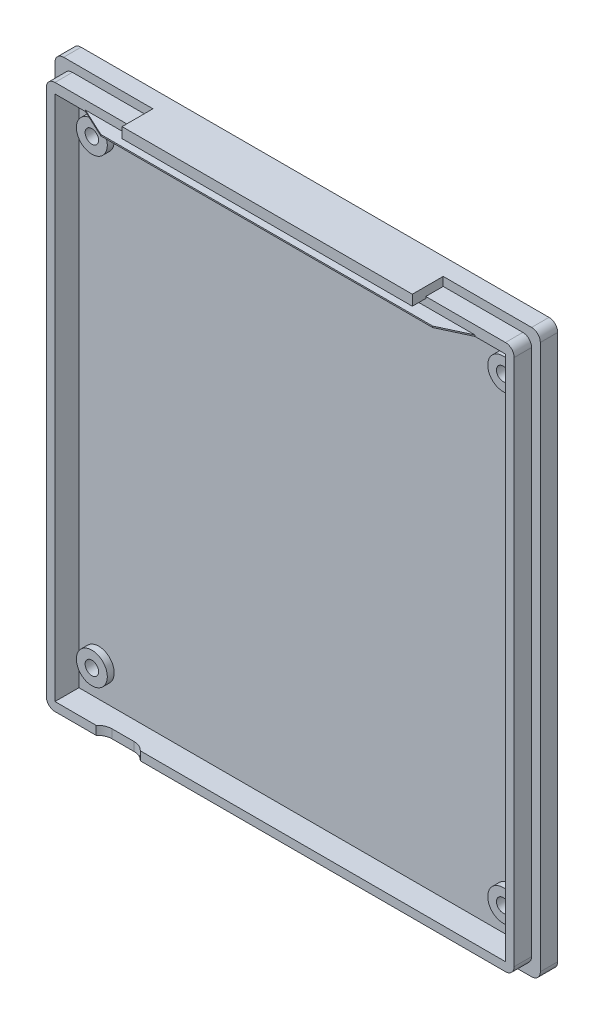
from build123d import *

# Parameters (mm, degrees)
DODANIE_WYCI_GNI_CIE1_DEPTH      = 0.5
DODANIE_WYCI_GNI_CIE1_DEPTH_BACK = 2
DODANIE_WYCI_GNI_CIE2_DEPTH      = 5.5
DODANIE_WYCI_GNI_CIE3_DEPTH      = 1.5
ZAOKR_GLENIE1_R                  = 2
SZKIC6_W                         = 66.685530181
SZKIC6_H                         = 2.4
DODANIE_WYCI_GNI_CIE4_DEPTH      = 8.59
DODANIE_WYCI_GNI_CIE5_DEPTH      = 8.59
WYTNIJ_WYCI_GNI_CIE1_DEPTH       = 5.5
SZKIC13_R                        = 3.55
SZKIC13_R_2                      = 1.6
SZKIC13_R_3                      = 1.55
DODANIE_WYCI_GNI_CIE7_DEPTH      = 1.57
SZKIC13_3_R                      = 1.55
WYTNIJ_WYCI_GNI_CIE2_DEPTH       = 90.285917207
WYTNIJ_WYCI_GNI_CIE3_DEPTH       = 2
SFAZOWANIE1_SIZE                 = 1.7


with BuildPart() as part:
    # Szkic3 → Dodanie-wyciągnięcie1 (new, two sides: drawn at the far end of the back side and taken through both)
    with BuildSketch(Plane(origin=(0, 0, -8.74), x_dir=(-1, 0, 0), z_dir=(0, 0, -1)).offset(-DODANIE_WYCI_GNI_CIE1_DEPTH_BACK)):
        Polygon((55.692889856, -69.15246634), (55.692892168, 60.038263946), (-55.811722529, 60.038263946), (-55.811687853, -69.161116694), align=None)
    extrude(amount=DODANIE_WYCI_GNI_CIE1_DEPTH + DODANIE_WYCI_GNI_CIE1_DEPTH_BACK)

    # Szkic4 → Dodanie-wyciągnięcie2 (add)
    with BuildSketch(Plane.XY.offset(-6.74)):
        Polygon((53.802147291, -67.151419689), (53.80218089, 58.038263946), (-53.683348754, 58.038263946), (-53.683348754, -67.143081129), align=None)
        Polygon((51.802147827, -65.151264526), (51.802180354, 56.038263946), (-51.683348754, 56.038263946), (-51.683348754, -65.14323628), align=None, mode=Mode.SUBTRACT)
    extrude(amount=DODANIE_WYCI_GNI_CIE2_DEPTH)

    # Szkic4<3> → Dodanie-wyciągnięcie3 (add)
    with BuildSketch(Plane.XY.offset(-6.74)):
        Polygon((-55.692892168, 60.038263946), (-55.692889856, -69.15246634), (55.811687853, -69.161116694), (55.811722529, 60.038263946), align=None)
        Polygon((-53.683348754, -67.143081129), (-53.683348754, 58.038263946), (53.80218089, 58.038263946), (53.802147291, -67.151419689), align=None, mode=Mode.SUBTRACT)
    extrude(amount=DODANIE_WYCI_GNI_CIE3_DEPTH)

    # Zaokrąglenie1
    zaokr_glenie1_edges = [part.edges().sort_by_distance(p)[0] for p in [
        (53.80218089, 58.038263946, -3.24),
        (-53.683348754, 58.038263946, -3.24),
        (-53.683348754, -67.143081129, -3.24),
        (53.802147291, -67.151419689, -3.24),
        (55.811687853, -69.161116694, -7.24),
        (55.811722529, 60.038263946, -7.24),
        (-55.692892168, 60.038263946, -7.24),
        (-55.692889856, -69.15246634, -7.24),
    ]]
    fillet(zaokr_glenie1_edges, radius=ZAOKR_GLENIE1_R)

    # Szkic6 → Dodanie-wyciągnięcie4 (add)
    with BuildSketch(Plane.XY.offset(-6.74)):
        with Locations((0.159416337, 58.838263946)):
            Rectangle(SZKIC6_W, SZKIC6_H)
    extrude(amount=DODANIE_WYCI_GNI_CIE4_DEPTH)

    # Szkic7 → Dodanie-wyciągnięcie5 (add)
    with BuildSketch(Plane.XY.offset(-6.74)):
        Polygon((-51.683348754, 55.738263946), (51.802180273, 55.738263946), (51.802180354, 56.038263946), (-51.683348754, 56.038263946), align=None)
    extrude(amount=DODANIE_WYCI_GNI_CIE5_DEPTH)

    # Szkic9 → Wytnij-wyciągnięcie1 (cut)
    with BuildSketch(Plane.XZ.offset(-55.738263946)):
        Polygon((51.802180273, 1.85), (38.175466286, 1.85), (44.80199267, -1.24), (51.80199267, -1.24), (51.802180273, -1.24), align=None)
        Polygon((-38.056977527, 1.85), (-51.683348754, 1.85), (-51.683348754, -1.24), (-44.683503911, -1.24), align=None)
    extrude(amount=-WYTNIJ_WYCI_GNI_CIE1_DEPTH, mode=Mode.SUBTRACT)

    # Szkic13 → Dodanie-wyciągnięcie7 (add)
    # profile 1 of 8: a face of its own
    with BuildSketch(Plane.XY.offset(-6.74)):
        with Locations((-47.14, 47.6022)):
            Circle(SZKIC13_R)
        with Locations((-47.14, 47.6022)):
            Circle(SZKIC13_R_2, mode=Mode.SUBTRACT)
    # profile 2 of 8: a face of its own
    with BuildSketch(Plane.XY.offset(-6.74)):
        with Locations((-47.14, 47.6022)):
            Circle(SZKIC13_R_2)
        with Locations((-47.14, 47.6022)):
            Circle(SZKIC13_R_3, mode=Mode.SUBTRACT)
    # profile 3 of 8: a face of its own
    with BuildSketch(Plane.XY.offset(-6.74)):
        with Locations((47.352, 47.6022)):
            Circle(SZKIC13_R)
        with Locations((47.352, 47.6022)):
            Circle(SZKIC13_R_2, mode=Mode.SUBTRACT)
    # profile 4 of 8: a face of its own
    with BuildSketch(Plane.XY.offset(-6.74)):
        with Locations((47.352, 47.6022)):
            Circle(SZKIC13_R_2)
        with Locations((47.352, 47.6022)):
            Circle(SZKIC13_R_3, mode=Mode.SUBTRACT)
    # profile 5 of 8: a face of its own
    with BuildSketch(Plane.XY.offset(-6.74)):
        with Locations((-47.14, -58.1478)):
            Circle(SZKIC13_R)
        with Locations((-47.14, -58.1478)):
            Circle(SZKIC13_R_2, mode=Mode.SUBTRACT)
    # profile 6 of 8: a face of its own
    with BuildSketch(Plane.XY.offset(-6.74)):
        with Locations((-47.14, -58.1478)):
            Circle(SZKIC13_R_2)
        with Locations((-47.14, -58.1478)):
            Circle(SZKIC13_R_3, mode=Mode.SUBTRACT)
    # profile 7 of 8: a face of its own
    with BuildSketch(Plane.XY.offset(-6.74)):
        with Locations((47.352, -58.1478)):
            Circle(SZKIC13_R)
        with Locations((47.352, -58.1478)):
            Circle(SZKIC13_R_2, mode=Mode.SUBTRACT)
    # profile 8 of 8: a face of its own
    with BuildSketch(Plane.XY.offset(-6.74)):
        with Locations((47.352, -58.1478)):
            Circle(SZKIC13_R_2)
        with Locations((47.352, -58.1478)):
            Circle(SZKIC13_R_3, mode=Mode.SUBTRACT)
    extrude(amount=DODANIE_WYCI_GNI_CIE7_DEPTH)

    # Szkic13<3> → Wytnij-wyciągnięcie2 (cut, through all)
    with BuildSketch(Plane.XY.offset(-6.74)):
        with Locations((-47.14, -58.1478)):
            Circle(SZKIC13_3_R)
        with Locations((-47.14, 47.6022)):
            Circle(SZKIC13_3_R)
        with Locations((47.352, 47.6022)):
            Circle(SZKIC13_3_R)
        with Locations((47.352, -58.1478)):
            Circle(SZKIC13_3_R)
    extrude(amount=-WYTNIJ_WYCI_GNI_CIE2_DEPTH, mode=Mode.SUBTRACT)

    # Szkic18 → Wytnij-wyciągnięcie3 (cut)
    with BuildSketch(Plane(origin=(-0.00520918, -67.147245397, 0), x_dir=(0.999999996990791, -7.757846392237927e-05, 0), z_dir=(-7.757846392237927e-05, -0.999999996990791, 0))):
        with BuildLine():
            ThreePointArc((-42.245261471, -1.24), (-41.074504923, -2.078778872), (-39.665102055, -2.375097025))
            Line((-39.665102055, -2.375097025), (-34.665098037, -2.375097025))
            ThreePointArc((-34.665098037, -2.375097025), (-33.255694971, -2.078778946), (-32.084938256, -1.24))
            Line((-32.084938256, -1.24), (-42.245261471, -1.24))
        make_face()
    extrude(amount=-WYTNIJ_WYCI_GNI_CIE3_DEPTH, mode=Mode.SUBTRACT)

    # Sfazowanie1
    sfazowanie1_edges = [part.edges().sort_by_distance(p)[0] for p in [
        (45.802, -58.1478, -9.24),
        (45.802, 47.6022, -9.24),
        (-48.69, 47.6022, -9.24),
        (-48.69, -58.1478, -9.24),
    ]]
    chamfer(sfazowanie1_edges, length=SFAZOWANIE1_SIZE)


solid = part.part
